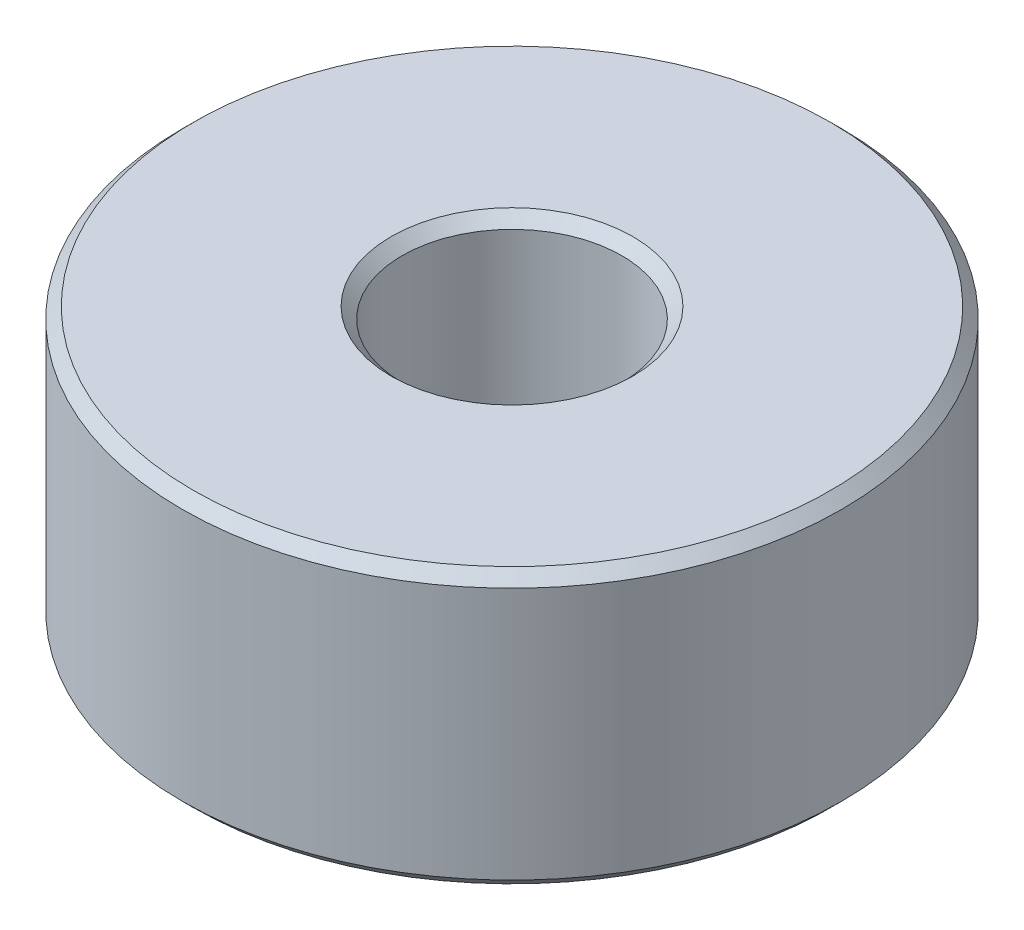
from build123d import *

# Parameters (mm, degrees)
SKETCH1_R           = 3
SKETCH1_R_2         = 1
BOSS_EXTRUDE1_DEPTH = 2.5
CHAMFER1_SIZE       = 0.1


with BuildPart() as part:
    # Sketch1 → Boss-Extrude1 (new body)
    with BuildSketch(Plane(origin=(0, 0, 0), x_dir=(1, 0, 0), z_dir=(0, 1, 0))):
        with Locations(Location((0, 0, 0), (0, 0, 270))):
            Circle(SKETCH1_R)
        with Locations(Location((0, 0, 0), (0, 0, 270))):
            Circle(SKETCH1_R_2, mode=Mode.SUBTRACT)
    extrude(amount=BOSS_EXTRUDE1_DEPTH)

    # Chamfer1
    chamfer1_edges = [part.edges().sort_by_distance(p)[0] for p in [
        (0, 0, -3),
        (0, 2.5, -3),
        (0, 0, -1),
        (0, 2.5, -1),
    ]]
    chamfer(chamfer1_edges, length=CHAMFER1_SIZE)


solid = part.part
